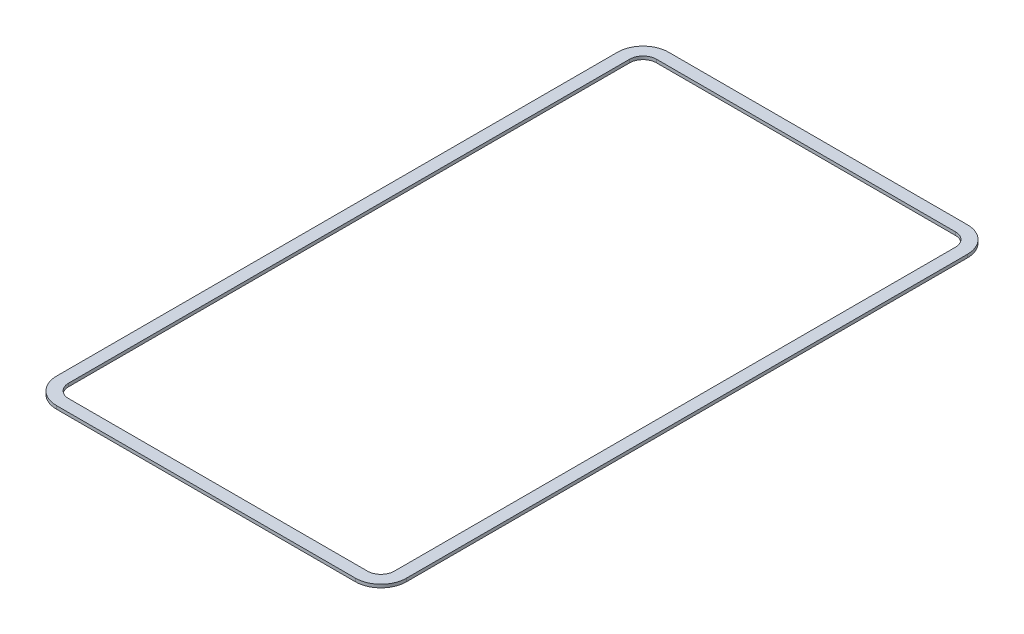
from build123d import *

# Parameters (mm, degrees)
BOSS_EXTRUDE1_DEPTH = 0.5


with BuildPart() as part:
    # Sketch2 → Boss-Extrude1 (new body)
    with BuildSketch(Plane(origin=(0, 0, 0), x_dir=(1, 0, 0), z_dir=(0, 1, 0))):
        with BuildLine():
            Line((-107.894695316, 57.414671815), (-61.008467659, 57.414671815))
            ThreePointArc((-61.008467659, 57.414671815), (-58.180040534, 56.243098939), (-57.008467659, 53.414671815))
            Line((-57.008467659, 53.414671815), (-57.008467659, -34.585328185))
            ThreePointArc((-57.008467659, -34.585328185), (-58.180040534, -37.41375531), (-61.008467659, -38.585328185))
            Line((-61.008467659, -38.585328185), (-107.894695316, -38.585328185))
            ThreePointArc((-107.894695316, -38.585328185), (-110.723122441, -37.41375531), (-111.894695316, -34.585328185))
            Line((-111.894695316, -34.585328185), (-111.894695316, 53.414671815))
            ThreePointArc((-111.894695316, 53.414671815), (-110.723122441, 56.243098939), (-107.894695316, 57.414671815))
        make_face()
        with BuildLine():
            Line((-109.994695316, 53.414671815), (-109.994695316, -34.585328185))
            ThreePointArc((-109.994695316, -34.585328185), (-109.379619557, -36.070252426), (-107.894695316, -36.685328185))
            Line((-107.894695316, -36.685328185), (-61.008467659, -36.685328185))
            ThreePointArc((-61.008467659, -36.685328185), (-59.523543419, -36.070252426), (-58.908467659, -34.585328185))
            Line((-58.908467659, -34.585328185), (-58.908467659, 53.414671815))
            ThreePointArc((-58.908467659, 53.414671815), (-59.523543419, 54.899596055), (-61.008467659, 55.514671815))
            Line((-61.008467659, 55.514671815), (-107.894695316, 55.514671815))
            ThreePointArc((-107.894695316, 55.514671815), (-109.379619557, 54.899596055), (-109.994695316, 53.414671815))
        make_face(mode=Mode.SUBTRACT)
    extrude(amount=BOSS_EXTRUDE1_DEPTH)


solid = part.part
